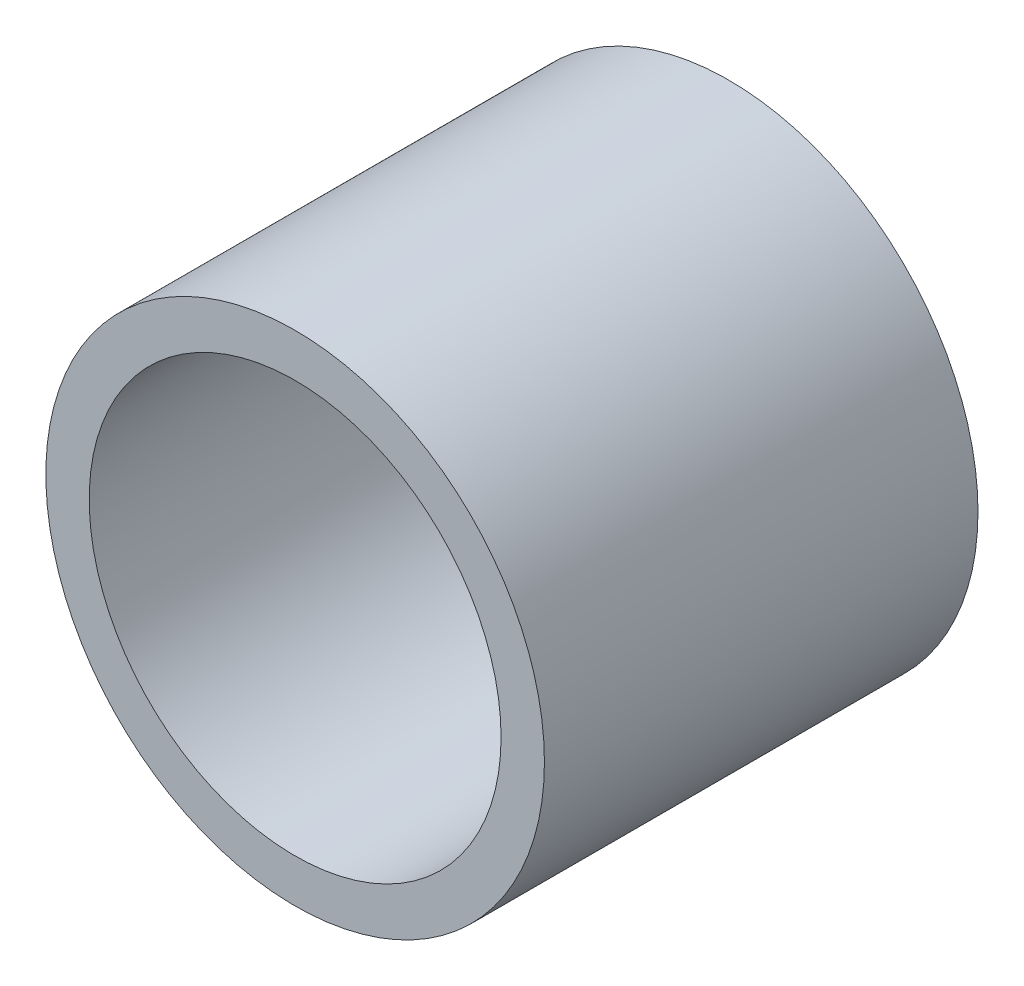
from build123d import *

# Parameters (mm, degrees)
SKETCH1_R           = 5.75
SKETCH1_R_2         = 4.75
BOSS_EXTRUDE1_DEPTH = 10


with BuildPart() as part:
    # Sketch1 → Boss-Extrude1 (new body)
    with BuildSketch(Plane.XY):
        Circle(SKETCH1_R)
        Circle(SKETCH1_R_2, mode=Mode.SUBTRACT)
    extrude(amount=BOSS_EXTRUDE1_DEPTH)


solid = part.part
